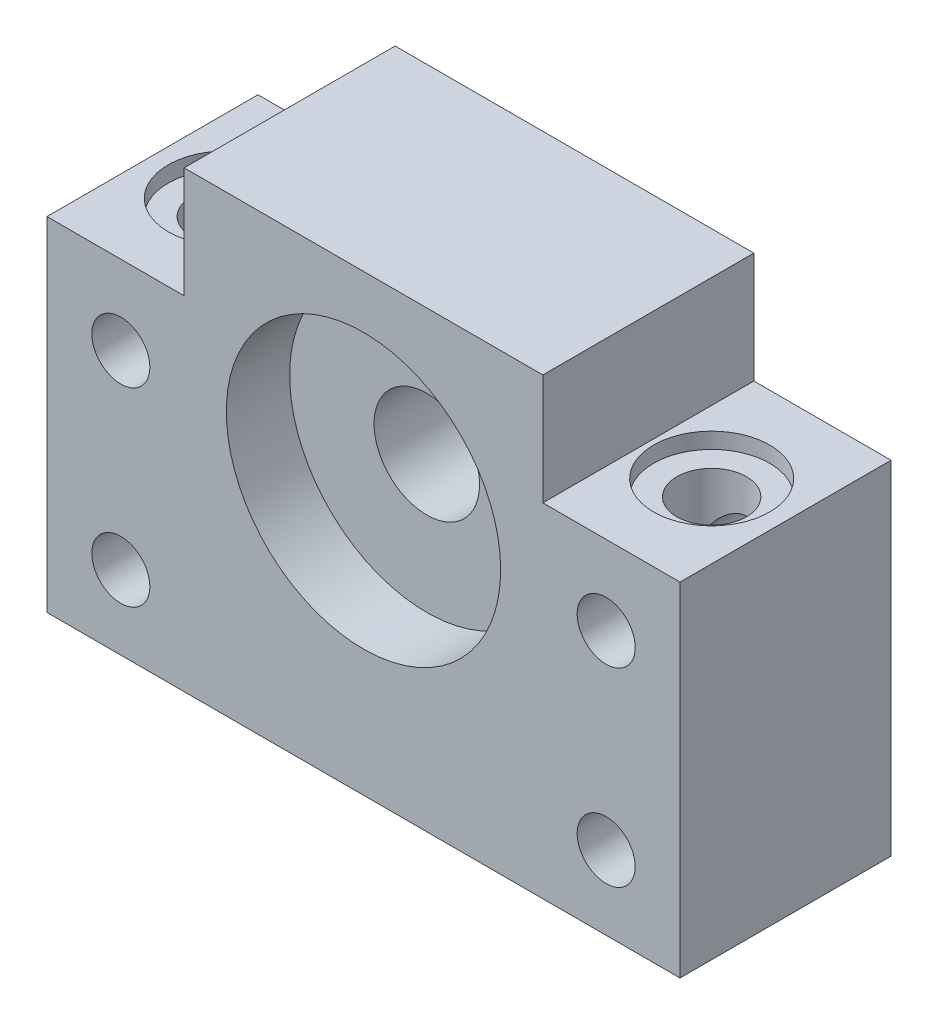
from build123d import *

# Parameters (mm, degrees)
CROQUIS1_R              = 2.75
SALIENTE_EXTRUIR1_DEPTH = 20
CROQUIS2_R              = 5
CORTAR_EXTRUIR1_DEPTH   = 20
CROQUIS3_R              = 13
CORTAR_EXTRUIR2_DEPTH   = 6
CORTAR_EXTRUIR3_START   = -6
CROQUIS4_R              = 13
CORTAR_EXTRUIR3_DEPTH   = 6
CROQUIS5_R              = 3.3
CORTAR_EXTRUIR4_DEPTH   = 72.107313267
CROQUIS6_R              = 5.5
CORTAR_EXTRUIR5_DEPTH   = 1.5


with BuildPart() as part:
    # Croquis1 → Saliente-Extruir1 (new body)
    with BuildSketch(Plane.XY):
        Polygon((0, 0), (60, 0), (60, 32.5), (47, 32.5), (47, 43), (13, 43), (13, 32.5), (0, 32.5), align=None)
        with Locations((7, 25)):
            Circle(CROQUIS1_R, mode=Mode.SUBTRACT)
        with Locations((53, 25)):
            Circle(CROQUIS1_R, mode=Mode.SUBTRACT)
        with Locations((53, 7)):
            Circle(CROQUIS1_R, mode=Mode.SUBTRACT)
        with Locations((7, 7)):
            Circle(CROQUIS1_R, mode=Mode.SUBTRACT)
    extrude(amount=SALIENTE_EXTRUIR1_DEPTH)

    # Croquis2 → Cortar-Extruir1 (cut)
    with BuildSketch(Plane.XY.offset(20)):
        with Locations((30, 25)):
            Circle(CROQUIS2_R)
    extrude(amount=-CORTAR_EXTRUIR1_DEPTH, mode=Mode.SUBTRACT)

    # Croquis3 → Cortar-Extruir2 (cut)
    with BuildSketch(Plane.XY.offset(20)):
        with Locations((30, 25)):
            Circle(CROQUIS3_R)
    extrude(amount=-CORTAR_EXTRUIR2_DEPTH, mode=Mode.SUBTRACT)

    # Croquis4 → Cortar-Extruir3 (cut)
    with BuildSketch(Plane(origin=(0, 0, 0), x_dir=(-1, 0, 0), z_dir=(0, 0, -1)).offset(CORTAR_EXTRUIR3_START)):
        with Locations(Location((-30, 25, 0), (0, 0, 180))):
            Circle(CROQUIS4_R)
    extrude(amount=CORTAR_EXTRUIR3_DEPTH, mode=Mode.SUBTRACT)

    # Croquis5 → Cortar-Extruir4 (cut, through all)
    with BuildSketch(Plane(origin=(0, 32.5, 0), x_dir=(1, 0, 0), z_dir=(0, 1, 0))):
        with Locations(Location((7, -10, 0), (0, 0, 270))):
            Circle(CROQUIS5_R)
        with Locations(Location((53, -10, 0), (0, 0, 270))):
            Circle(CROQUIS5_R)
    extrude(amount=-CORTAR_EXTRUIR4_DEPTH, mode=Mode.SUBTRACT)

    # Croquis6 → Cortar-Extruir5 (cut)
    with BuildSketch(Plane(origin=(0, 32.5, 0), x_dir=(1, 0, 0), z_dir=(0, 1, 0))):
        with Locations(Location((7, -10, 0), (0, 0, 270))):
            Circle(CROQUIS6_R)
        with Locations(Location((53, -10, 0), (0, 0, 270))):
            Circle(CROQUIS6_R)
    extrude(amount=-CORTAR_EXTRUIR5_DEPTH, mode=Mode.SUBTRACT)


solid = part.part
